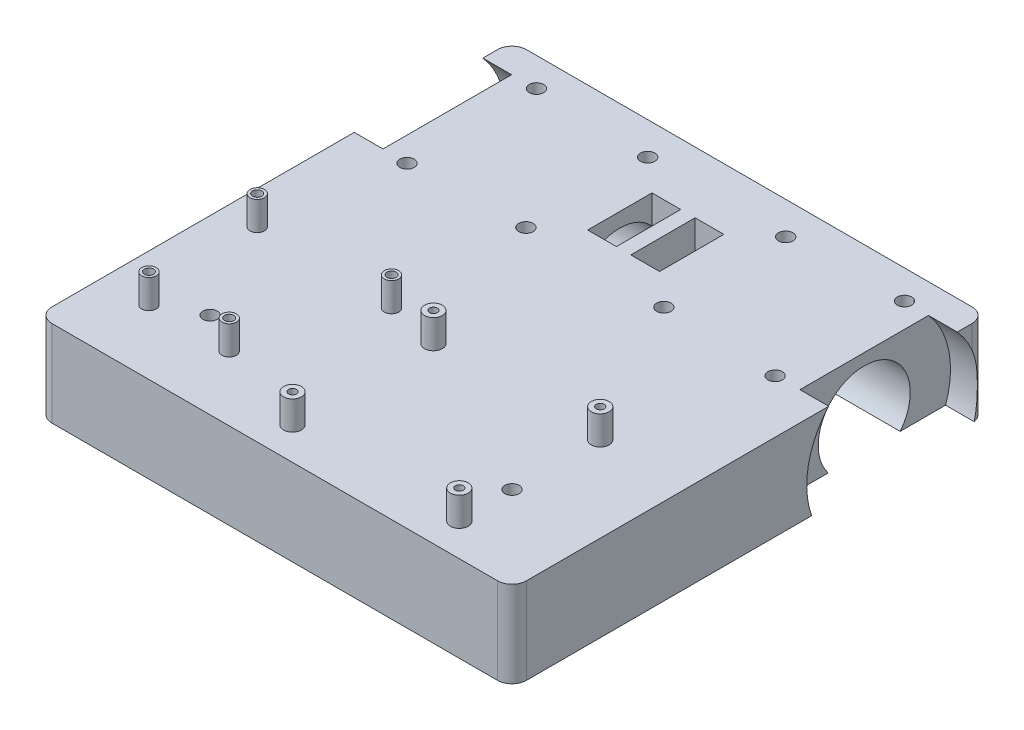
from build123d import *

# Parameters (mm, degrees)
ESQUISSE2_W           = 165
ESQUISSE2_H           = 165
BASE_DEPTH            = 30
ESQUISSE3_R           = 15
BLOC_MOTEUR_1_DEPTH   = 80
ESQUISSE4_W           = 10
ESQUISSE4_H           = 22.360679774
ACCES_MOTEUR_DEPTH    = 37
ESQUISSE6_R           = 16.01
BLOC_MOTEUR_2_DEPTH   = 37
ESQUISSE7_R           = 2.5
VIS_MOTEUR_DEPTH      = 121.467838032
ESQUISSE8_R           = 2.5
VIS_PATIN_DEPTH       = 121.467838032
ESQUISSE9_R           = 3.1
ESQUISSE9_R_2         = 1.375
SUPPORT_RASP_DEPTH    = 10
ESQUISSE11_R          = 2.5
ESQUISSE11_R_2        = 1.6
SUPPORT_ARDUINO_DEPTH = 10
CONGE_EXT_R           = 5
ESQUISSE12_R          = 30
ESPACE_ROUE_DEPTH     = 10


with BuildPart() as part:
    # Esquisse2 → BASE (new body)
    with BuildSketch(Plane(origin=(0, 0, 0), x_dir=(1, 0, 0), z_dir=(0, 1, 0))):
        Rectangle(ESQUISSE2_W, ESQUISSE2_H)
    extrude(amount=BASE_DEPTH)

    # Esquisse3 → BLOC MOTEUR 1. (cut)
    with BuildSketch(Plane(origin=(82.5, 0, 0), x_dir=(0, 0, -1), z_dir=(1, 0, 0))):
        with Locations((50, 10)):
            Circle(ESQUISSE3_R)
    bloc_moteur_1 = extrude(amount=-BLOC_MOTEUR_1_DEPTH, mode=Mode.SUBTRACT)

    # Esquisse4 → ACCES MOTEUR (cut)
    with BuildSketch(Plane.XZ):
        with Locations((7.5, -50)):
            Rectangle(ESQUISSE4_W, ESQUISSE4_H)
    acces_moteur = extrude(amount=-ACCES_MOTEUR_DEPTH, mode=Mode.SUBTRACT)

    # Esquisse6 → BLOC MOTEUR 2 (cut)
    with BuildSketch(Plane(origin=(82.5, 0, 0), x_dir=(0, 0, -1), z_dir=(1, 0, 0))):
        with Locations((50, 10)):
            Circle(ESQUISSE6_R)
    bloc_moteur_2 = extrude(amount=-BLOC_MOTEUR_2_DEPTH, mode=Mode.SUBTRACT)

    # SYM BLOC MOTEUR: BLOC MOTEUR 1., ACCES MOTEUR, BLOC MOTEUR 2 across plane
    add(bloc_moteur_1.mirror(Plane(origin=(0, 0, 0), x_dir=(0, 0, 1), z_dir=(1, 0, 0))), mode=Mode.SUBTRACT)
    add(acces_moteur.mirror(Plane(origin=(0, 0, 0), x_dir=(0, 0, 1), z_dir=(1, 0, 0))), mode=Mode.SUBTRACT)
    add(bloc_moteur_2.mirror(Plane(origin=(0, 0, 0), x_dir=(0, 0, 1), z_dir=(1, 0, 0))), mode=Mode.SUBTRACT)

    # Esquisse7 → VIS MOTEUR (cut, through all)
    with BuildSketch(Plane.XZ):
        with Locations(Location((-64, -27.497196314, 0), (0, 0, 270))):
            Circle(ESQUISSE7_R)
        with Locations(Location((-24, -28.819660113, 0), (0, 0, 270))):
            Circle(ESQUISSE7_R)
        with Locations(Location((-24, -71.180339887, 0), (0, 0, 270))):
            Circle(ESQUISSE7_R)
        with Locations(Location((-64, -72.502803686, 0), (0, 0, 270))):
            Circle(ESQUISSE7_R)
    vis_moteur = extrude(amount=-VIS_MOTEUR_DEPTH, mode=Mode.SUBTRACT)

    # SYM VIS: VIS MOTEUR across plane
    add(vis_moteur.mirror(Plane(origin=(0, 0, 0), x_dir=(0, 0, 1), z_dir=(1, 0, 0))), mode=Mode.SUBTRACT)

    # Esquisse8 → VIS PATIN (cut, through all)
    with BuildSketch(Plane.XZ):
        with Locations(Location((-52.5, 52.5, 0), (0, 0, 270))):
            Circle(ESQUISSE8_R)
        with Locations(Location((52.5, 52.5, 0), (0, 0, 270))):
            Circle(ESQUISSE8_R)
    extrude(amount=-VIS_PATIN_DEPTH, mode=Mode.SUBTRACT)

    # Esquisse9 → SUPPORT RASP (add)
    # profile 1 of 4: a face of its own
    with BuildSketch(Plane(origin=(0, 30, 0), x_dir=(1, 0, 0), z_dir=(0, 1, 0))):
        with Locations(Location((-5.124679211, -22.194338496, 0), (0, 0, 90))):
            Circle(ESQUISSE9_R)
        with Locations(Location((-5.124679211, -22.194338496, 0), (0, 0, 270))):
            Circle(ESQUISSE9_R_2, mode=Mode.SUBTRACT)
    # profile 2 of 4: a face of its own
    with BuildSketch(Plane(origin=(0, 30, 0), x_dir=(1, 0, 0), z_dir=(0, 1, 0))):
        with Locations(Location((52.875320789, -22.194338496, 0), (0, 0, 90))):
            Circle(ESQUISSE9_R)
        with Locations(Location((52.875320789, -22.194338496, 0), (0, 0, 270))):
            Circle(ESQUISSE9_R_2, mode=Mode.SUBTRACT)
    # profile 3 of 4: a face of its own
    with BuildSketch(Plane(origin=(0, 30, 0), x_dir=(1, 0, 0), z_dir=(0, 1, 0))):
        with Locations(Location((-5.124679211, -71.194338496, 0), (0, 0, 90))):
            Circle(ESQUISSE9_R)
        with Locations(Location((-5.124679211, -71.194338496, 0), (0, 0, 270))):
            Circle(ESQUISSE9_R_2, mode=Mode.SUBTRACT)
    # profile 4 of 4: a face of its own
    with BuildSketch(Plane(origin=(0, 30, 0), x_dir=(1, 0, 0), z_dir=(0, 1, 0))):
        with Locations(Location((52.875320789, -71.194338496, 0), (0, 0, 90))):
            Circle(ESQUISSE9_R)
        with Locations(Location((52.875320789, -71.194338496, 0), (0, 0, 270))):
            Circle(ESQUISSE9_R_2, mode=Mode.SUBTRACT)
    extrude(amount=SUPPORT_RASP_DEPTH)

    # Esquisse11 → SUPPORT ARDUINO (add)
    # profile 1 of 4: a face of its own
    with BuildSketch(Plane(origin=(0, 30, 0), x_dir=(1, 0, 0), z_dir=(0, 1, 0))):
        with Locations(Location((-70.933772323, -17.670594659, 0), (0, 0, 90))):
            Circle(ESQUISSE11_R)
        with Locations(Location((-70.933772323, -17.670594659, 0), (0, 0, 270))):
            Circle(ESQUISSE11_R_2, mode=Mode.SUBTRACT)
    # profile 2 of 4: a face of its own
    with BuildSketch(Plane(origin=(0, 30, 0), x_dir=(1, 0, 0), z_dir=(0, 1, 0))):
        with Locations(Location((-23.123772323, -18.770594659, 0), (0, 0, 90))):
            Circle(ESQUISSE11_R)
        with Locations(Location((-23.123772323, -18.770594659, 0), (0, 0, 270))):
            Circle(ESQUISSE11_R_2, mode=Mode.SUBTRACT)
    # profile 3 of 4: a face of its own
    with BuildSketch(Plane(origin=(0, 30, 0), x_dir=(1, 0, 0), z_dir=(0, 1, 0))):
        with Locations(Location((-66.233772323, -60.010594659, 0), (0, 0, 90))):
            Circle(ESQUISSE11_R)
        with Locations(Location((-66.233772323, -60.010594659, 0), (0, 0, 270))):
            Circle(ESQUISSE11_R_2, mode=Mode.SUBTRACT)
    # profile 4 of 4: a face of its own
    with BuildSketch(Plane(origin=(0, 30, 0), x_dir=(1, 0, 0), z_dir=(0, 1, 0))):
        with Locations(Location((-38.333772323, -60.010594659, 0), (0, 0, 90))):
            Circle(ESQUISSE11_R)
        with Locations(Location((-38.333772323, -60.010594659, 0), (0, 0, 270))):
            Circle(ESQUISSE11_R_2, mode=Mode.SUBTRACT)
    extrude(amount=SUPPORT_ARDUINO_DEPTH)

    # CONGE EXT
    conge_ext_edges = [part.edges().sort_by_distance(p)[0] for p in [
        (-82.5, 15, -82.5),
        (82.5, 15, -82.5),
        (82.5, 15, 82.5),
        (-82.5, 15, 82.5),
    ]]
    fillet(conge_ext_edges, radius=CONGE_EXT_R)

    # Esquisse12 → ESPACE ROUE (cut)
    with BuildSketch(Plane.ZY.offset(82.5)):
        with Locations((-50, 10)):
            Circle(ESQUISSE12_R)
    espace_roue = extrude(amount=-ESPACE_ROUE_DEPTH, mode=Mode.SUBTRACT)

    # SYM ESPACE ROUE: ESPACE ROUE across plane
    add(espace_roue.mirror(Plane(origin=(0, 0, 0), x_dir=(0, 0, 1), z_dir=(1, 0, 0))), mode=Mode.SUBTRACT)


solid = part.part
